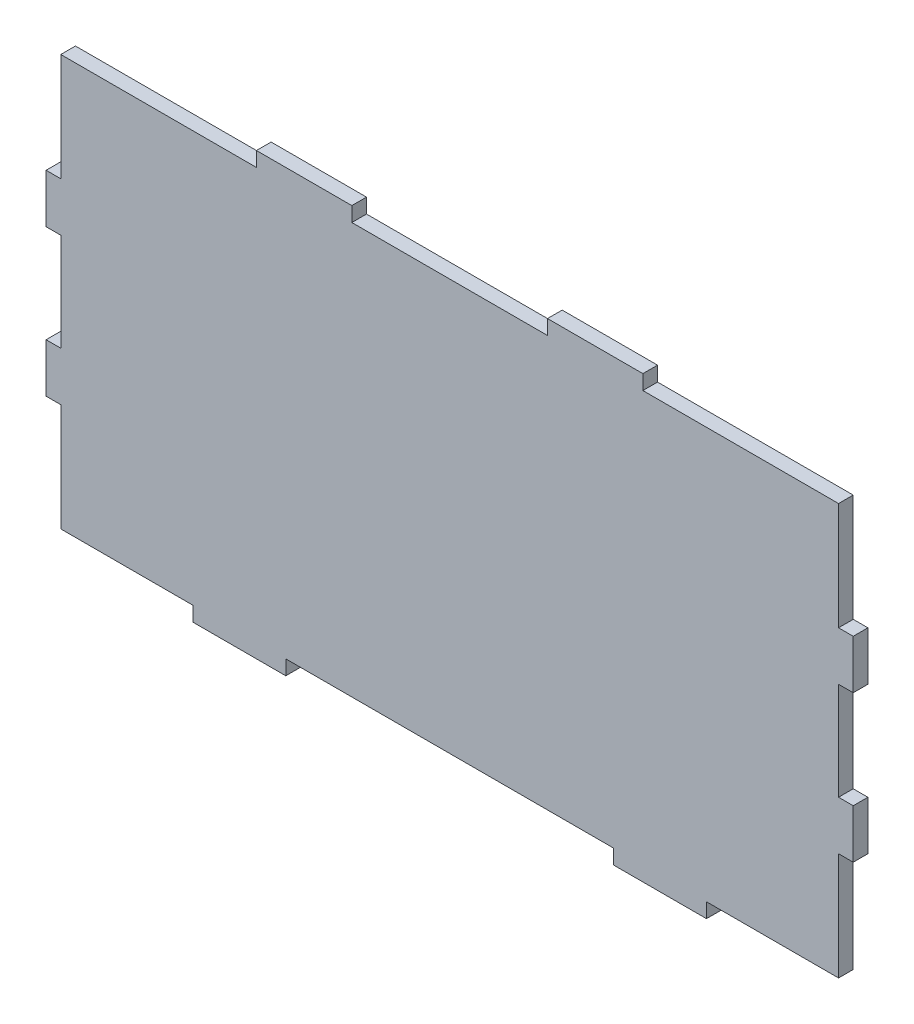
from build123d import *

# Parameters (mm, degrees)
ESQUISSE1_W             = 330
ESQUISSE1_H             = 180
BOSS_EXTRU_1_DEPTH      = 6
ESQUISSE2_W             = 6
ESQUISSE2_H             = 40
ESQUISSE2_W_2           = 80
ESQUISSE2_H_2           = 6
ESQUISSE2_W_3           = 134
ENL_V_MAT_EXTRU_1_DEPTH = 376.946804748


with BuildPart() as part:
    # Esquisse1 → Boss.-Extru.1 (new body)
    with BuildSketch(Plane.XY):
        with Locations((-165, 90)):
            Rectangle(ESQUISSE1_W, ESQUISSE1_H)
    extrude(amount=BOSS_EXTRU_1_DEPTH)

    # Esquisse2 → Enlèv. mat.-Extru.1 (cut, through all)
    with BuildSketch(Plane.XY.offset(6)):
        Polygon((-330, 180), (-330, 130), (-324, 130), (-324, 174), (-244, 174), (-244, 180), align=None)
        Polygon((-330, 0), (-330, 50), (-324, 50), (-324, 6), (-270, 6), (-270, 0), align=None)
        with Locations((-327, 90)):
            Rectangle(ESQUISSE2_W, ESQUISSE2_H)
        Polygon((0, 180), (0, 130), (-6, 130), (-6, 174), (-86, 174), (-86, 180), align=None)
        Polygon((0, 0), (0, 50), (-6, 50), (-6, 6), (-60, 6), (-60, 0), align=None)
        with Locations((-3, 90)):
            Rectangle(ESQUISSE2_W, ESQUISSE2_H)
        with Locations((-165, 177)):
            Rectangle(ESQUISSE2_W_2, ESQUISSE2_H_2)
        with Locations((-165, 3)):
            Rectangle(ESQUISSE2_W_3, ESQUISSE2_H_2)
    extrude(amount=-ENL_V_MAT_EXTRU_1_DEPTH, mode=Mode.SUBTRACT)


solid = part.part
